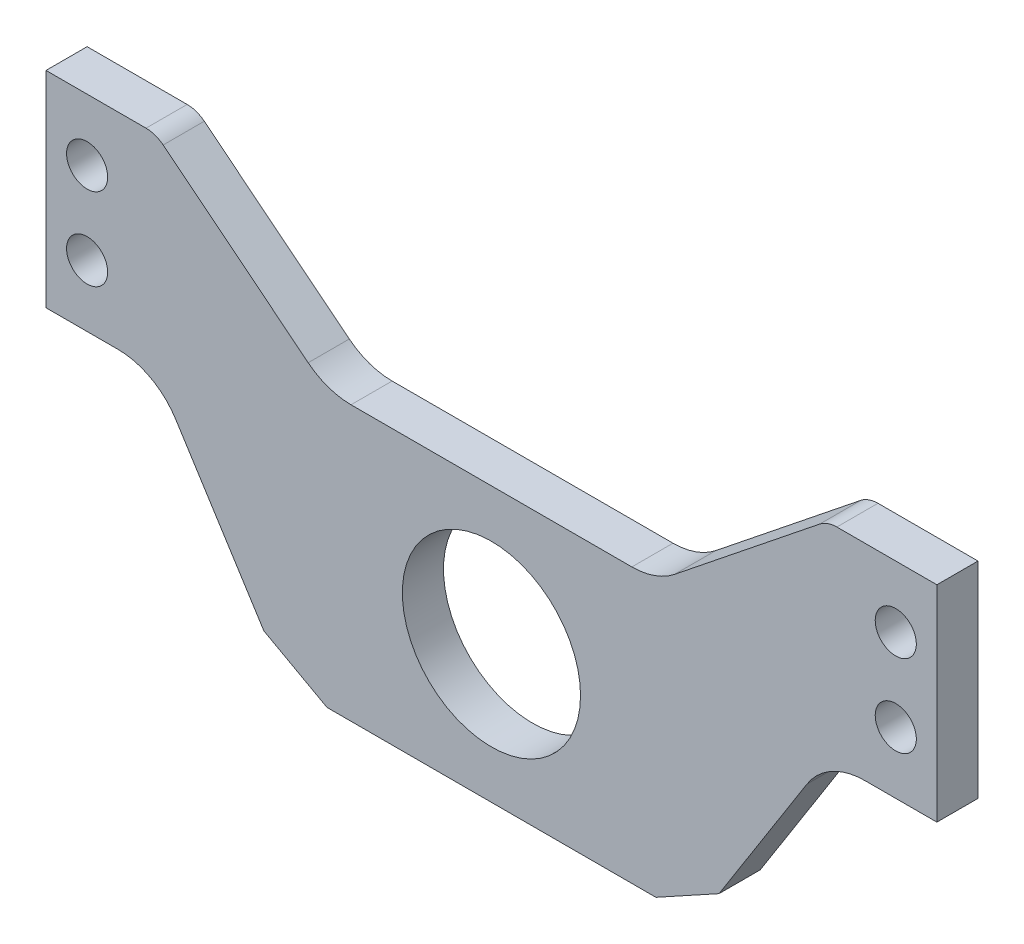
from build123d import *

# Parameters (mm, degrees)
SKETCH_1_R      = 6.5
SKETCH_1_R_2    = 1.5
EXTRUDE_1_DEPTH = 3
FILLET_1_R      = 5
CHAMFER_1_SIZE  = 3
FILLET_3_R      = 5
FILLET_4_R      = 2


with BuildPart() as part:
    # 草图1 → 凸台-拉伸1 (new body)
    with BuildSketch(Plane.XY):
        Polygon((15, -10), (-15, -10), (-24.5, 5), (-32.5, 5), (-32.5, 20), (-24.5, 20), (-12, 10), (12, 10), (24.5, 20), (32.5, 20), (32.5, 5), (24.5, 5), align=None)
        Circle(SKETCH_1_R, mode=Mode.SUBTRACT)
        with Locations((-29.5, 15.5)):
            Circle(SKETCH_1_R_2, mode=Mode.SUBTRACT)
        with Locations(Location((29.5, 9.5, 0), (0, 0, 180))):
            Circle(SKETCH_1_R_2, mode=Mode.SUBTRACT)
        with Locations((-29.5, 9.5)):
            Circle(SKETCH_1_R_2, mode=Mode.SUBTRACT)
        with Locations(Location((29.5, 15.5, 0), (0, 0, 180))):
            Circle(SKETCH_1_R_2, mode=Mode.SUBTRACT)
    extrude(amount=EXTRUDE_1_DEPTH)

    # 圆角1
    fillet_1_edges = [part.edges().sort_by_distance(p)[0] for p in [
        (-12, 10, 1.5),
        (12, 10, 1.5),
    ]]
    fillet(fillet_1_edges, radius=FILLET_1_R)

    # 倒角1
    chamfer_1_edges = [part.edges().sort_by_distance(p)[0] for p in [
        (15, -10, 1.5),
        (-15, -10, 1.5),
    ]]
    chamfer(chamfer_1_edges, length=CHAMFER_1_SIZE)

    # 圆角3
    fillet_3_edges = [part.edges().sort_by_distance(p)[0] for p in [
        (-24.5, 5, 1.5),
        (24.5, 5, 1.5),
    ]]
    fillet(fillet_3_edges, radius=FILLET_3_R)

    # 圆角4
    fillet_4_edges = [part.edges().sort_by_distance(p)[0] for p in [
        (-24.5, 20, 1.5),
        (24.5, 20, 1.5),
    ]]
    fillet(fillet_4_edges, radius=FILLET_4_R)


solid = part.part
